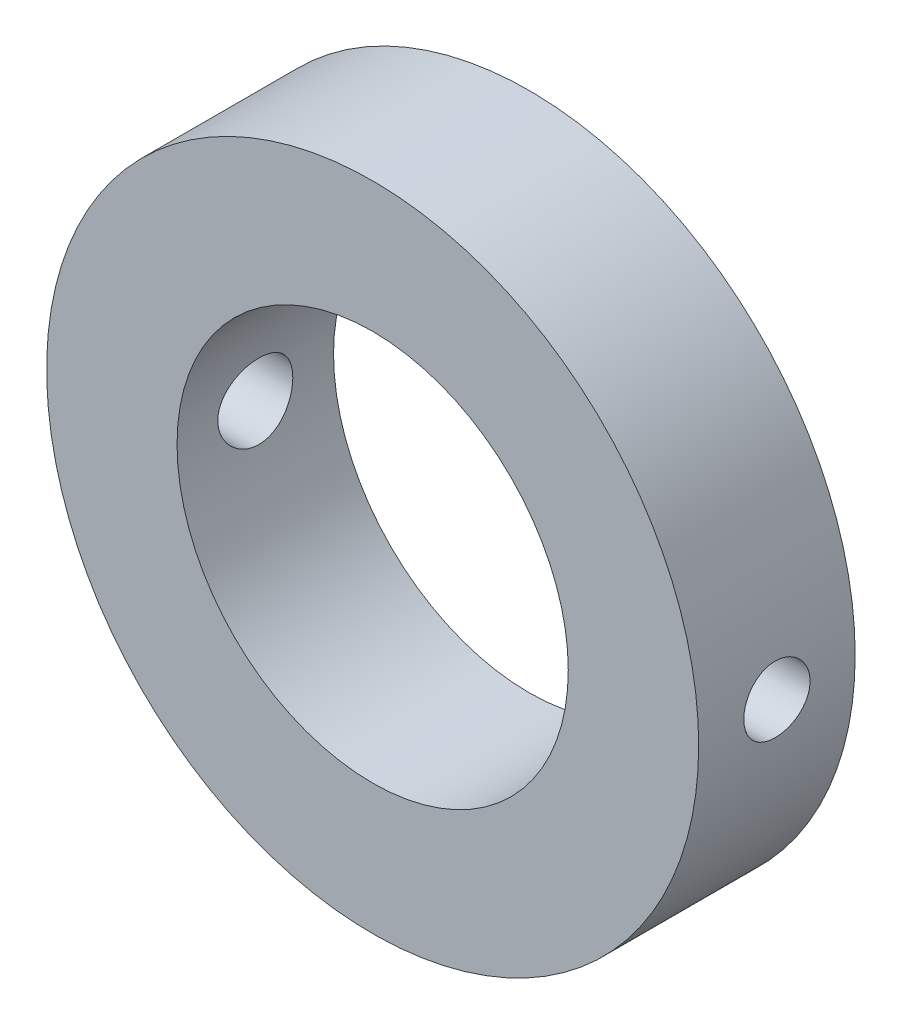
from build123d import *

# Parameters (mm, degrees)
SKETCH2_R           = 25
SKETCH2_R_2         = 15
BOSS_EXTRUDE1_DEPTH = 6


with BuildPart() as part:
    # Sketch2 → Boss-Extrude1 (new, symmetric)
    with BuildSketch(Plane.XY):
        Circle(SKETCH2_R)
        Circle(SKETCH2_R_2, mode=Mode.SUBTRACT)
    extrude(amount=BOSS_EXTRUDE1_DEPTH, both=True)

    # Sketch5 → Cut-Revolve1 (revolve, cut)
    with BuildSketch(Plane.XY, mode=Mode.PRIVATE) as cut_revolve1_sk:
        Polygon((-30, 3), (-30, 0), (30, 0), (30, 2.5), align=None)
    revolve(cut_revolve1_sk.sketch.rotate(Axis((30, 0, 0), (-1, 0, 0)), 90.000000002), axis=Axis((30, 0, 0), (-1, 0, 0)), mode=Mode.SUBTRACT)


solid = part.part
